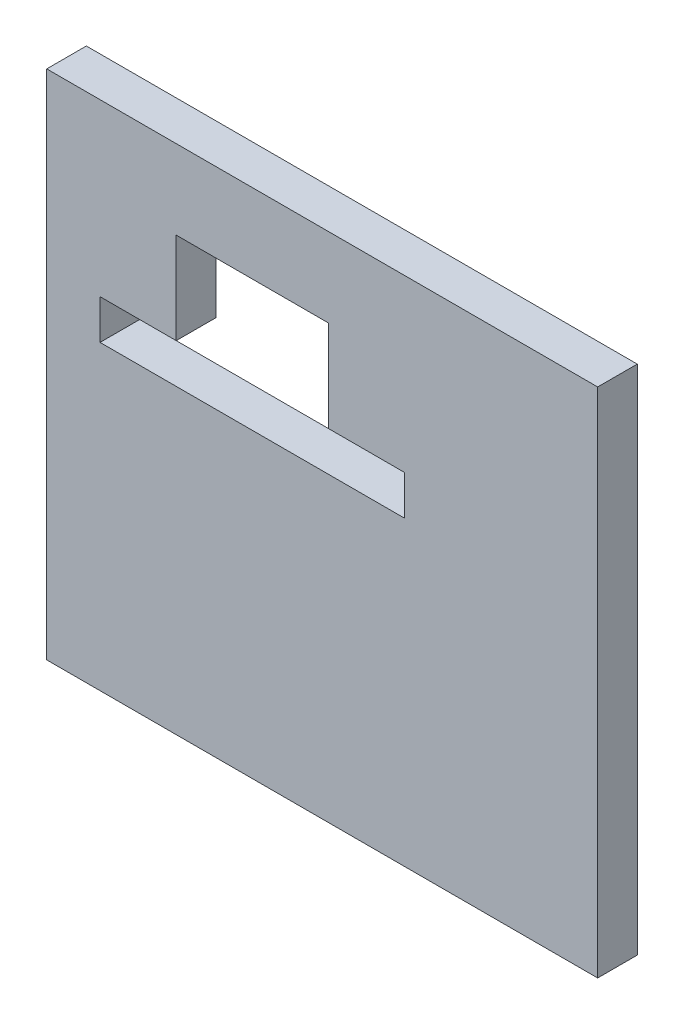
from build123d import *

# Parameters (mm, degrees)
BOSS_EXTRUDE1_DEPTH = 5.2


with BuildPart() as part:
    # Sketch1 → Boss-Extrude1 (new body)
    with BuildSketch(Plane.XY):
        Polygon((0, 22.4), (0, 0), (72.33, 0), (72.33, 22.4), (72.33, 27.6), (72.33, 39.6), (72.33, 44.8), (72.33, 67.2), (0, 67.2), (0, 44.8), (0, 39.6), (0, 27.6), align=None)
        Polygon((17, 44.8), (17, 56.8), (37, 56.8), (37, 44.8), (47, 44.8), (47, 39.6), (7, 39.6), (7, 44.8), align=None, mode=Mode.SUBTRACT)
    extrude(amount=BOSS_EXTRUDE1_DEPTH)


solid = part.part
